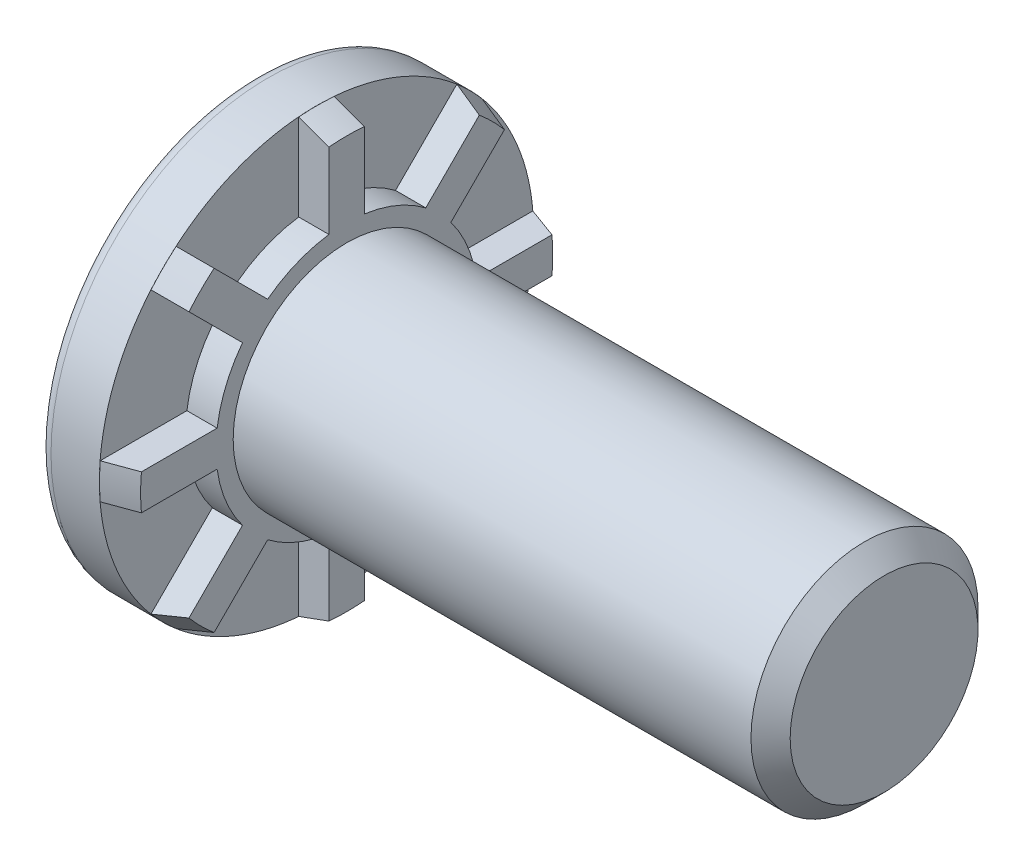
from build123d import *

# Parameters (mm, degrees)
RIBCUT_START     = -1.065
RIBCUT_DEPTH     = 1.065
RIBCUTSPAT_COUNT = 8
RIBCUTSPAT_ANGLE = 315


with BuildPart() as part:
    # BodySke → BaseBody (revolve)
    with BuildSketch(Plane.XY):
        with BuildLine():
            Line((-2.13, 7.224), (-2.13, 0))
            Line((-2.13, 0), (20, 0))
            Line((20, 0), (20, 3.3095))
            Line((20, 3.3095), (19.3095, 4))
            Line((19.3095, 4), (1.065, 4))
            Line((1.065, 4), (1.065, 7.260756185))
            Line((1.065, 7.260756185), (0.00254, 7.64746))
            Line((0.00254, 7.64746), (0, 7.64746))
            Line((0, 7.64746), (0, 7.65))
            Line((0, 7.65), (-1.704, 7.65))
            ThreePointArc((-1.704, 7.65), (-2.005227489, 7.525227489), (-2.13, 7.224))
        make_face()
    revolve(axis=Axis((0, 0, 0), (1, 0, 0)))

    # RibCutSke → RibCut (cut)
    with BuildSketch(Plane(origin=(1.065, 1.794401132, -0.090952894), x_dir=(0, 0, -1), z_dir=(1, 0, 0)).offset(RIBCUT_START)):
        with BuildLine():
            Line((0.534784966, 2.771251969), (0.534784966, 5.829964555))
            ThreePointArc((0.534784966, 5.829964555), (2.836575363, 5.273277291), (4.857824301, 4.039303031))
            Line((4.857824301, 4.039303031), (2.69498789, 1.87646662))
            ThreePointArc((2.69498789, 1.87646662), (1.672579923, 2.463143713), (0.534784966, 2.771251969))
        make_face()
    ribcut = extrude(amount=RIBCUT_DEPTH, mode=Mode.SUBTRACT)

    # RibCutsPat: RibCut ×8 about axis
    ribcutspat_axis = Axis((0, 0, 0), (1, 0, 0))
    for i in range(1, RIBCUTSPAT_COUNT):
        add(ribcut.rotate(ribcutspat_axis, i * RIBCUTSPAT_ANGLE / (RIBCUTSPAT_COUNT - 1)), mode=Mode.SUBTRACT)


solid = part.part
